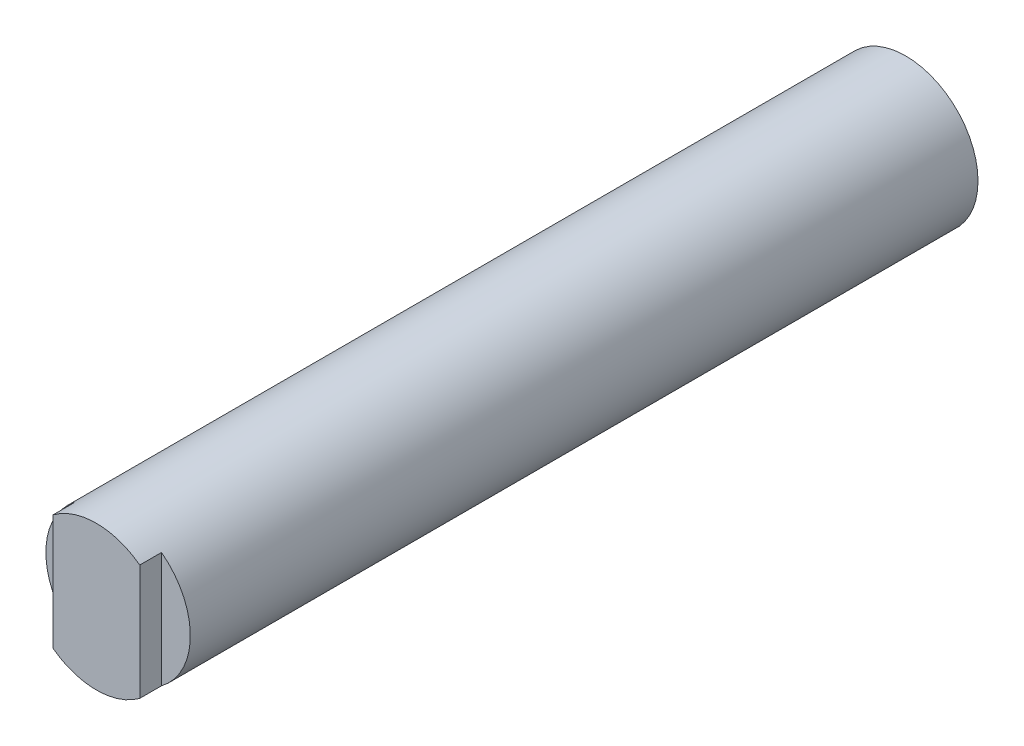
from build123d import *

# Parameters (mm, degrees)
SKETCH1_R           = 26.3525
BOSS_EXTRUDE1_DEPTH = 295.275
CUT_EXTRUDE1_START  = -7.9375
CUT_EXTRUDE1_DEPTH  = 7.9375


with BuildPart() as part:
    # Sketch1 → Boss-Extrude1 (new body)
    with BuildSketch(Plane.XY):
        Circle(SKETCH1_R)
    extrude(amount=BOSS_EXTRUDE1_DEPTH)

    # Sketch2 → Cut-Extrude1 (cut)
    with BuildSketch(Plane.XY.offset(295.275).offset(CUT_EXTRUDE1_START)):
        with BuildLine():
            Line((-15.8369, 21.06292607), (-15.8369, -21.06292607))
            ThreePointArc((-15.8369, -21.06292607), (-26.3525, 0), (-15.8369, 21.06292607))
        make_face()
        with BuildLine():
            Line((15.8369, -21.06292607), (15.8369, 21.06292607))
            ThreePointArc((15.8369, 21.06292607), (26.3525, 0), (15.8369, -21.06292607))
        make_face()
    extrude(amount=CUT_EXTRUDE1_DEPTH, mode=Mode.SUBTRACT)


solid = part.part
